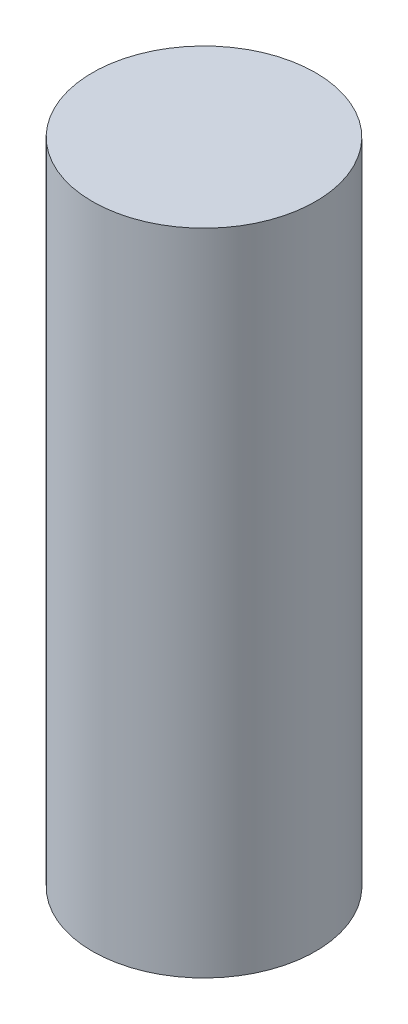
from build123d import *

# Parameters (mm, degrees)
SKETCH1_R           = 27.5
BOSS_EXTRUDE1_DEPTH = 160


with BuildPart() as part:
    # Sketch1 → Boss-Extrude1 (new body)
    with BuildSketch(Plane(origin=(0, 0, 0), x_dir=(1, 0, 0), z_dir=(0, 1, 0))):
        with Locations(Location((0, 0, 0), (0, 0, 270))):
            Circle(SKETCH1_R)
    extrude(amount=BOSS_EXTRUDE1_DEPTH)


solid = part.part
